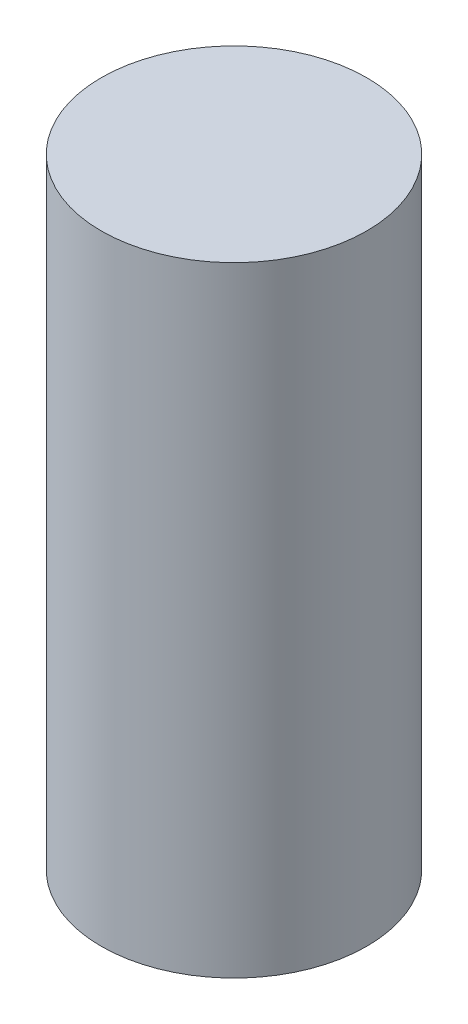
from build123d import *

# Parameters (mm, degrees)
OVEN_AYAR_MIL_2_START = 12
SKETCH1_R             = 6
OVEN_AYAR_MIL_2_DEPTH = 28


with BuildPart() as part:
    # Sketch1 → OVEN_ayar_mil_2 (new body)
    with BuildSketch(Plane(origin=(0, 0, 0), x_dir=(1, 0, 0), z_dir=(0, 1, 0)).offset(OVEN_AYAR_MIL_2_START)):
        with Locations(Location((650, 50, 0), (0, 0, 270))):
            Circle(SKETCH1_R)
    extrude(amount=OVEN_AYAR_MIL_2_DEPTH)


solid = part.part
